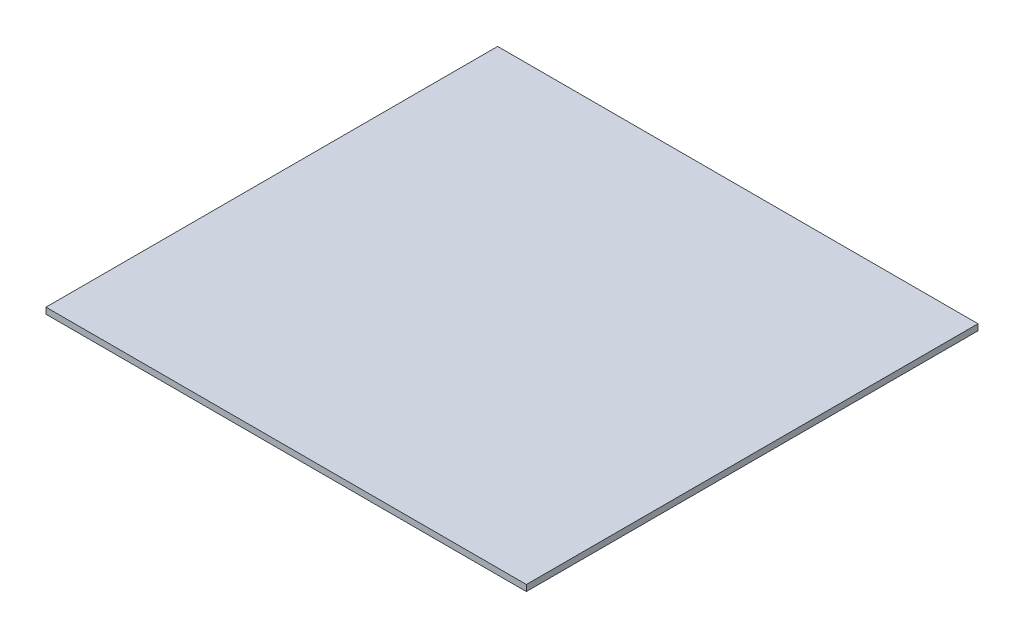
from build123d import *

# Parameters (mm, degrees)
SKETCH1_W           = 117
SKETCH1_H           = 110
BOSS_EXTRUDE1_DEPTH = 1.5


with BuildPart() as part:
    # Sketch1 → Boss-Extrude1 (new body)
    with BuildSketch(Plane(origin=(0, 0, 0), x_dir=(1, 0, 0), z_dir=(0, 1, 0))):
        Rectangle(SKETCH1_W, SKETCH1_H)
    extrude(amount=BOSS_EXTRUDE1_DEPTH)


solid = part.part
